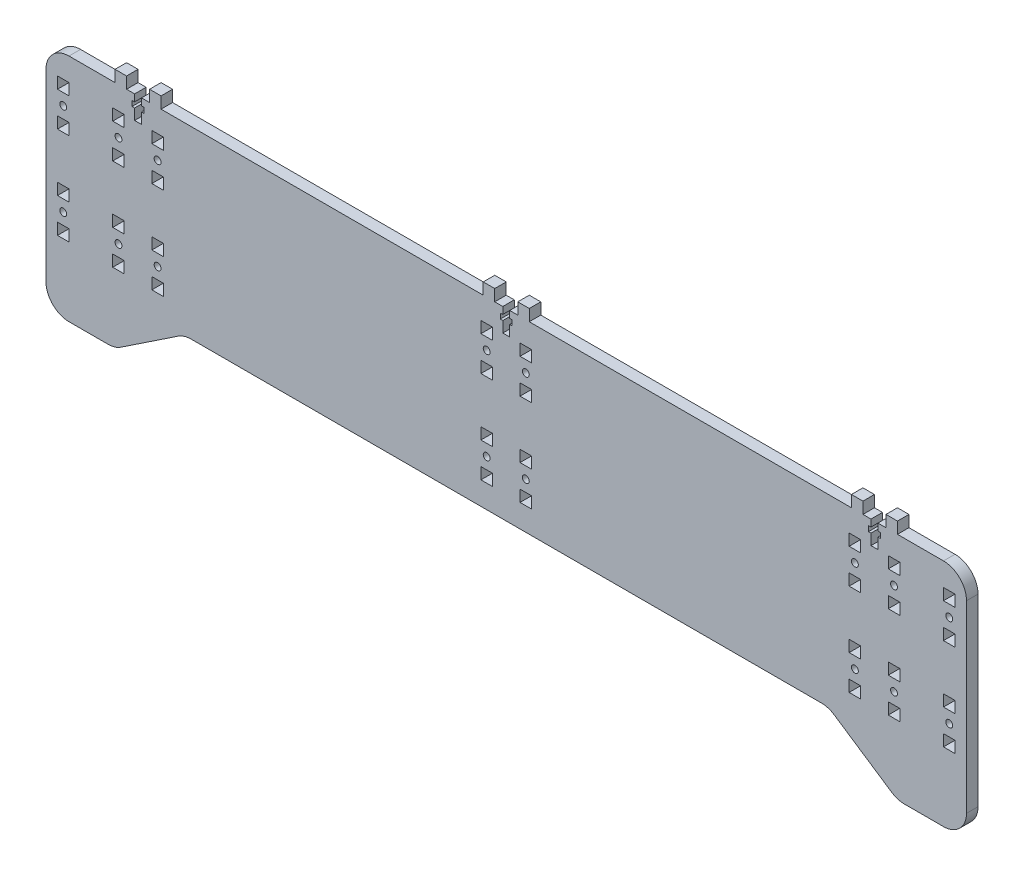
from build123d import *

# Parameters (mm, degrees)
SKETCH1_R           = 1.5
SKETCH1_W           = 5
SKETCH1_H           = 5
BOSS_EXTRUDE1_DEPTH = 5
CONG_1_R            = 10


with BuildPart() as part:
    # Sketch1 → Boss-Extrude1 (new body)
    with BuildSketch(Plane.XY):
        Polygon((1.5, 0), (5, 0), (5, 5), (10, 5), (10, 0), (150, 0), (150, 5), (155, 5), (155, 0), (158.5, 0), (158.5, -3), (157.4, -3), (157.4, -5.3), (158.5, -5.3), (158.5, -10), (161.5, -10), (161.5, -5.3), (162.6, -5.3), (162.6, -3), (161.5, -3), (161.5, 0), (165, 0), (165, 5), (170, 5), (170, 0), (200, 0), (200, -100), (170, -100), (140, -80), (-140, -80), (-170, -100), (-200, -100), (-200, 0), (-170, 0), (-170, 5), (-165, 5), (-165, 0), (-161.5, 0), (-161.5, -3), (-162.6, -3), (-162.6, -5.3), (-161.5, -5.3), (-161.5, -10), (-158.5, -10), (-158.5, -5.3), (-157.4, -5.3), (-157.4, -3), (-158.5, -3), (-158.5, 0), (-155, 0), (-155, 5), (-150, 5), (-150, 0), (-10, 0), (-10, 5), (-5, 5), (-5, 0), (-1.5, 0), (-1.5, -3), (-2.6, -3), (-2.6, -5.3), (-1.5, -5.3), (-1.5, -10), (1.5, -10), (1.5, -5.3), (2.6, -5.3), (2.6, -3), (1.5, -3), align=None)
        with Locations((151.5, -60)):
            Circle(SKETCH1_R, mode=Mode.SUBTRACT)
        with Locations((8.5, -60)):
            Circle(SKETCH1_R, mode=Mode.SUBTRACT)
        with Locations((-151.5, -60)):
            Circle(SKETCH1_R, mode=Mode.SUBTRACT)
        with Locations((-151.5, -20)):
            Circle(SKETCH1_R, mode=Mode.SUBTRACT)
        with Locations((8.5, -20)):
            Circle(SKETCH1_R, mode=Mode.SUBTRACT)
        with Locations((151.5, -20)):
            Circle(SKETCH1_R, mode=Mode.SUBTRACT)
        with Locations((192.5, -20)):
            Circle(SKETCH1_R, mode=Mode.SUBTRACT)
        with Locations((192.5, -60)):
            Circle(SKETCH1_R, mode=Mode.SUBTRACT)
        with Locations((-192.5, -60)):
            Circle(SKETCH1_R, mode=Mode.SUBTRACT)
        with Locations((-192.5, -20)):
            Circle(SKETCH1_R, mode=Mode.SUBTRACT)
        with Locations((168.5, -20)):
            Circle(SKETCH1_R, mode=Mode.SUBTRACT)
        with Locations((168.5, -60)):
            Circle(SKETCH1_R, mode=Mode.SUBTRACT)
        with Locations(Location((-8.5, -60, 0), (0, 0, 180))):
            Circle(SKETCH1_R, mode=Mode.SUBTRACT)
        with Locations(Location((-8.5, -20, 0), (0, 0, 180))):
            Circle(SKETCH1_R, mode=Mode.SUBTRACT)
        with Locations(Location((-168.5, -60, 0), (0, 0, 180))):
            Circle(SKETCH1_R, mode=Mode.SUBTRACT)
        with Locations(Location((-168.5, -20, 0), (0, 0, 180))):
            Circle(SKETCH1_R, mode=Mode.SUBTRACT)
        with Locations((151.5, -52.5)):
            Rectangle(SKETCH1_W, SKETCH1_H, mode=Mode.SUBTRACT)
        with Locations((151.5, -67.5)):
            Rectangle(SKETCH1_W, SKETCH1_H, mode=Mode.SUBTRACT)
        with Locations((8.5, -52.5)):
            Rectangle(SKETCH1_W, SKETCH1_H, mode=Mode.SUBTRACT)
        with Locations((8.5, -67.5)):
            Rectangle(SKETCH1_W, SKETCH1_H, mode=Mode.SUBTRACT)
        with Locations((-151.5, -52.5)):
            Rectangle(SKETCH1_W, SKETCH1_H, mode=Mode.SUBTRACT)
        with Locations((-151.5, -67.5)):
            Rectangle(SKETCH1_W, SKETCH1_H, mode=Mode.SUBTRACT)
        with Locations((-151.5, -12.5)):
            Rectangle(SKETCH1_W, SKETCH1_H, mode=Mode.SUBTRACT)
        with Locations((-151.5, -27.5)):
            Rectangle(SKETCH1_W, SKETCH1_H, mode=Mode.SUBTRACT)
        with Locations((8.5, -12.5)):
            Rectangle(SKETCH1_W, SKETCH1_H, mode=Mode.SUBTRACT)
        with Locations((8.5, -27.5)):
            Rectangle(SKETCH1_W, SKETCH1_H, mode=Mode.SUBTRACT)
        with Locations((151.5, -12.5)):
            Rectangle(SKETCH1_W, SKETCH1_H, mode=Mode.SUBTRACT)
        with Locations((151.5, -27.5)):
            Rectangle(SKETCH1_W, SKETCH1_H, mode=Mode.SUBTRACT)
        with Locations((192.5, -12.5)):
            Rectangle(SKETCH1_W, SKETCH1_H, mode=Mode.SUBTRACT)
        with Locations((192.5, -27.5)):
            Rectangle(SKETCH1_W, SKETCH1_H, mode=Mode.SUBTRACT)
        with Locations((192.5, -52.5)):
            Rectangle(SKETCH1_W, SKETCH1_H, mode=Mode.SUBTRACT)
        with Locations((192.5, -67.5)):
            Rectangle(SKETCH1_W, SKETCH1_H, mode=Mode.SUBTRACT)
        with Locations((-192.5, -52.5)):
            Rectangle(SKETCH1_W, SKETCH1_H, mode=Mode.SUBTRACT)
        with Locations((-192.5, -67.5)):
            Rectangle(SKETCH1_W, SKETCH1_H, mode=Mode.SUBTRACT)
        with Locations((-192.5, -12.5)):
            Rectangle(SKETCH1_W, SKETCH1_H, mode=Mode.SUBTRACT)
        with Locations((-192.5, -27.5)):
            Rectangle(SKETCH1_W, SKETCH1_H, mode=Mode.SUBTRACT)
        with Locations((168.5, -12.5)):
            Rectangle(SKETCH1_W, SKETCH1_H, mode=Mode.SUBTRACT)
        with Locations((168.5, -27.5)):
            Rectangle(SKETCH1_W, SKETCH1_H, mode=Mode.SUBTRACT)
        with Locations((168.5, -52.5)):
            Rectangle(SKETCH1_W, SKETCH1_H, mode=Mode.SUBTRACT)
        with Locations((168.5, -67.5)):
            Rectangle(SKETCH1_W, SKETCH1_H, mode=Mode.SUBTRACT)
        with Locations((-8.5, -52.5)):
            Rectangle(SKETCH1_W, SKETCH1_H, mode=Mode.SUBTRACT)
        with Locations((-8.5, -67.5)):
            Rectangle(SKETCH1_W, SKETCH1_H, mode=Mode.SUBTRACT)
        with Locations((-8.5, -12.5)):
            Rectangle(SKETCH1_W, SKETCH1_H, mode=Mode.SUBTRACT)
        with Locations((-8.5, -27.5)):
            Rectangle(SKETCH1_W, SKETCH1_H, mode=Mode.SUBTRACT)
        with Locations((-168.5, -52.5)):
            Rectangle(SKETCH1_W, SKETCH1_H, mode=Mode.SUBTRACT)
        with Locations((-168.5, -67.5)):
            Rectangle(SKETCH1_W, SKETCH1_H, mode=Mode.SUBTRACT)
        with Locations((-168.5, -12.5)):
            Rectangle(SKETCH1_W, SKETCH1_H, mode=Mode.SUBTRACT)
        with Locations((-168.5, -27.5)):
            Rectangle(SKETCH1_W, SKETCH1_H, mode=Mode.SUBTRACT)
    extrude(amount=BOSS_EXTRUDE1_DEPTH)

    # Congé1
    cong_1_edges = [part.edges().sort_by_distance(p)[0] for p in [
        (200, 0, 2.5),
        (200, -100, 2.5),
        (170, -100, 2.5),
        (140, -80, 2.5),
        (-140, -80, 2.5),
        (-170, -100, 2.5),
        (-200, -100, 2.5),
        (-200, 0, 2.5),
    ]]
    fillet(cong_1_edges, radius=CONG_1_R)


solid = part.part
